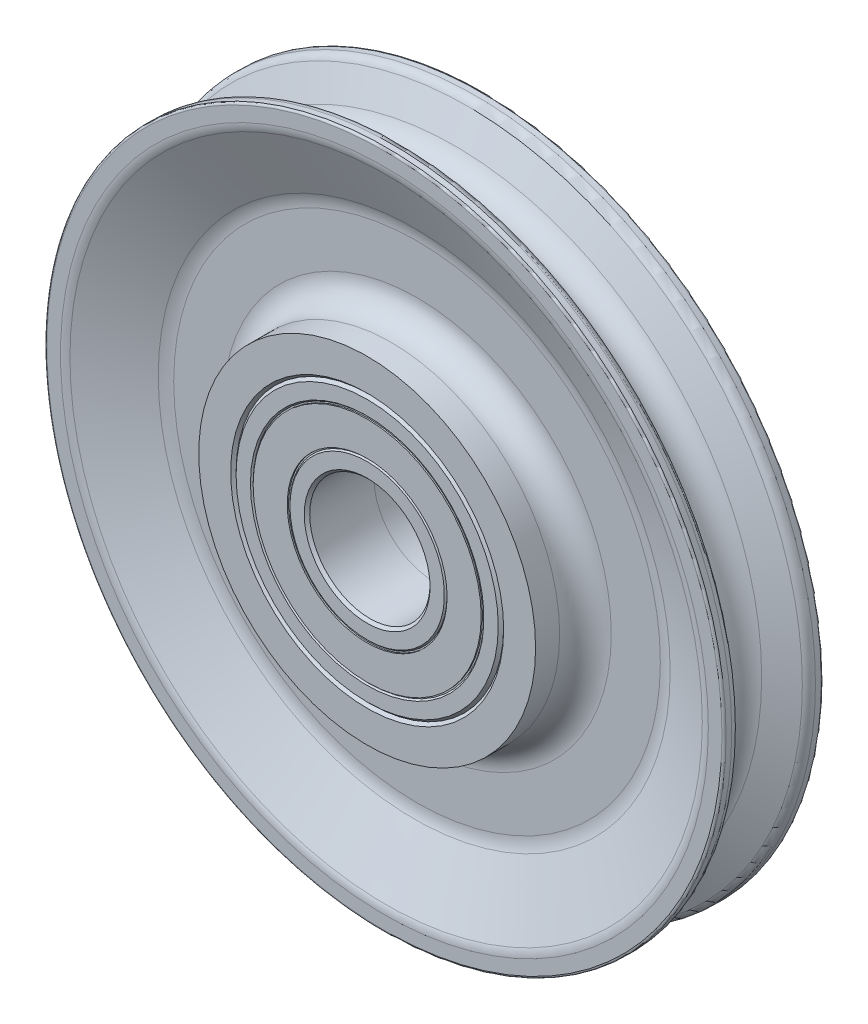
from build123d import *
from build123d.topology import SkipClean

# Parameters (mm, degrees)
CHAMFER1_SIZE      = 0.508
SKETCH5_W          = 2.032
SKETCH5_H          = 13.769
SKETCH7_R          = 43.1535
SKETCH7_R_2        = 42.6455
SKETCH7_R_3        = 29.8925
SKETCH7_R_4        = 29.3845
CUT_EXTRUDE1_DEPTH = 0.508
CHAMFER4_SIZE      = 1.016


with BuildPart() as part:
    # Sketch4 → Revolve1 (revolve)
    with BuildSketch(Plane(origin=(0, 0, 0), x_dir=(0, 0, -1), z_dir=(1, 0, 0)), mode=Mode.PRIVATE) as revolve1_sk:
        Polygon((-24.9936, 22.5), (0, 22.5), (0, 50.038), (-23.9776, 50.038), (-24.9936, 49.022), (-24.9936, 43.1535), (-22.9616, 43.1535), (-22.9616, 29.3845), (-24.9936, 29.3845), align=None)
    revolve(revolve1_sk.sketch.rotate(Axis((0, 0, 24.9936), (0, 0, -1)), 90), axis=Axis((0, 0, 24.9936), (0, 0, -1)))

    # Chamfer1
    chamfer1_edges = [part.edges().sort_by_distance(p)[0] for p in [
        (-29.3845, 0, 24.9936),
        (-43.1535, 0, 24.9936),
    ]]
    chamfer(chamfer1_edges, length=CHAMFER1_SIZE)

    # Chamfer4
    chamfer4_edges = [part.edges().sort_by_distance(p)[0] for p in [
        (-22.5, 0, 24.9936),
    ]]
    chamfer(chamfer4_edges, length=CHAMFER4_SIZE)


with BuildPart() as body_2:
    # Sketch5 → Revolve2 (revolve)
    with BuildSketch(Plane(origin=(0, 0, 0), x_dir=(0, 0, -1), z_dir=(1, 0, 0)), mode=Mode.PRIVATE) as revolve2_sk:
        with Locations((-23.9776, 36.269)):
            Rectangle(SKETCH5_W, SKETCH5_H)
    revolve(revolve2_sk.sketch.rotate(Axis((0, 0, 24.9936), (0, 0, -1)), 90), axis=Axis((0, 0, 24.9936), (0, 0, -1)))

    # Sketch7 → Cut-Extrude1 (cut)
    # profile 1 of 2: a face of its own
    with BuildSketch(Plane.XY.offset(24.9936)):
        Circle(SKETCH7_R)
        Circle(SKETCH7_R_2, mode=Mode.SUBTRACT)
    # profile 2 of 2: a face of its own
    with BuildSketch(Plane.XY.offset(24.9936)):
        Circle(SKETCH7_R_3)
        Circle(SKETCH7_R_4, mode=Mode.SUBTRACT)
    extrude(amount=-CUT_EXTRUDE1_DEPTH, mode=Mode.SUBTRACT)


with BuildPart() as body_3:
    # Mirror1: mirrored copy
    add(body_2.part.mirror(Plane.XY))


with BuildPart() as body_4:
    # Mirror1 2: mirrored copy
    add(part.part.mirror(Plane.XY))


with BuildPart() as body_5:
    # Sketch6 → Revolve3 (revolve)
    with BuildSketch(Plane(origin=(0, 0, 0), x_dir=(0, 0, -1), z_dir=(1, 0, 0)), mode=Mode.PRIVATE) as revolve3_sk:
        with BuildLine():
            Line((-23.9776, 50.038), (-24.9936, 51.054))
            Line((-24.9936, 51.054), (-24.9936, 62.992))
            Line((-24.9936, 62.992), (-16.002, 62.992))
            ThreePointArc((-16.002, 62.992), (-9.177005348, 65.819005348), (-6.35, 72.644))
            Line((-6.35, 72.644), (-6.35, 90.99434045))
            ThreePointArc((-6.35, 90.99434045), (-6.614915824, 93.413269576), (-7.397104172, 95.717522144))
            Line((-7.397104172, 95.717522144), (-17.899458803, 118.239894332))
            ThreePointArc((-17.899458803, 118.239894332), (-18.379438017, 119.653867499), (-18.542, 121.138210371))
            Line((-18.542, 121.138210371), (-18.542, 126.238))
            ThreePointArc((-18.542, 126.238), (-18.318815367, 126.776815367), (-17.78, 127))
            Line((-17.78, 127), (-15.659410645, 127))
            ThreePointArc((-15.659410645, 127), (-13.885247338, 126.482878554), (-12.666782332, 125.0934855))
            Line((-12.666782332, 125.0934855), (-7.826874049, 114.714268692))
            ThreePointArc((-7.826874049, 114.714268692), (-4.640119418, 111.080471474), (0, 109.728))
            Line((0, 109.728), (0, 50.038))
            Line((0, 50.038), (-23.9776, 50.038))
        make_face()
    revolve(revolve3_sk.sketch.rotate(Axis((0, 0, 24.9936), (0, 0, -1)), 90), axis=Axis((0, 0, 24.9936), (0, 0, -1)))

    # Mirror2: body 5 across plane


with BuildPart() as body_5_1:
    with SkipClean():  # the faces are left unmerged after this step: merging them gives an invalid solid
        add(body_5.part)
        add(body_5.part.mirror(Plane(origin=(0, 109.728, 0), x_dir=(1, 0, 0), z_dir=(0, 0, 1))))


solid = Compound([part.part, body_2.part, body_3.part, body_4.part, body_5_1.part])
